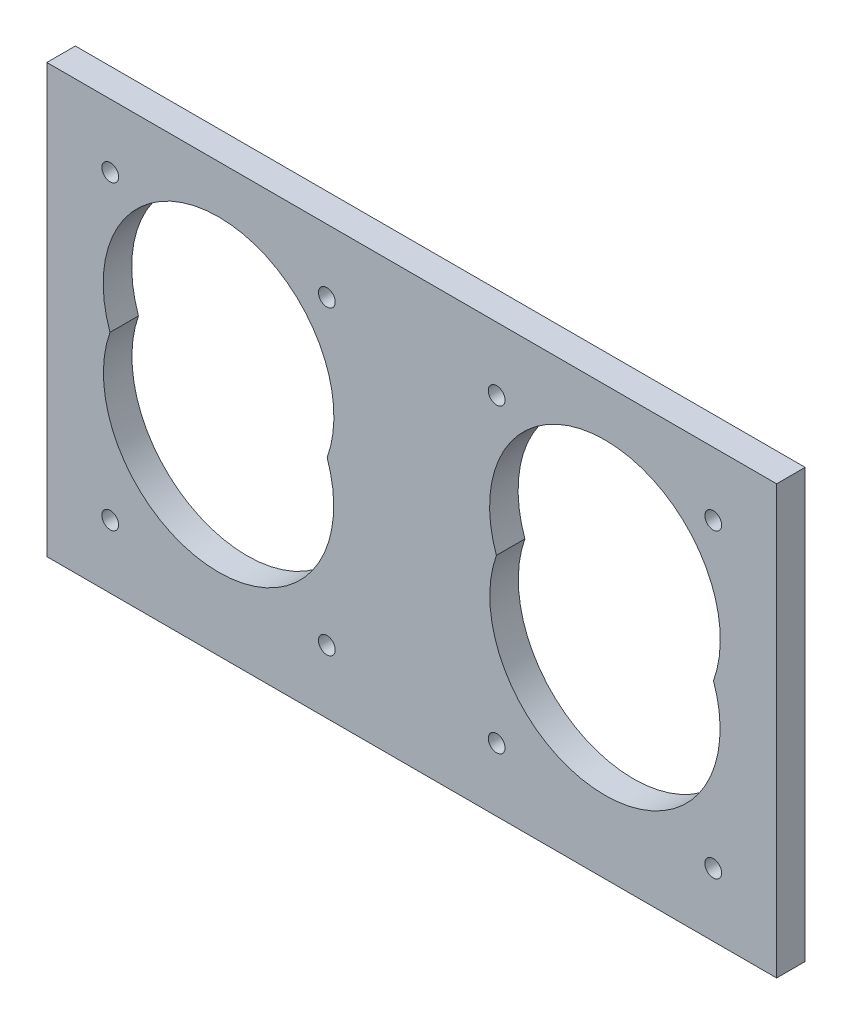
from build123d import *

# Parameters (mm, degrees)
SKETCH1_W           = 64.012274628
SKETCH1_H           = 75.085000506
BOSS_EXTRUDE1_DEPTH = 5
SKETCH7_R           = 1.4732
CUT_EXTRUDE1_DEPTH  = 10


with BuildPart() as part:
    # Sketch1 → Boss-Extrude1 (new body)
    # profile 1 of 2: a face of its own
    with BuildSketch(Plane.XY):
        with Locations((61.398411242, 7.077500224)):
            Rectangle(SKETCH1_W, SKETCH1_H)
        with BuildLine():
            ThreePointArc((83.484398078, 2.429730903), (59.871437613, -17.479677368), (44.238109553, 9.157805497))
            ThreePointArc((44.238109553, 9.157805497), (59.81501285, 35.930775127), (83.520814038, 15.994205484))
            ThreePointArc((83.520814038, 15.994205484), (83.22114917, 12.52456978), (82.331029644, 9.157693158))
            ThreePointArc((82.331029644, 9.157693158), (83.193968093, 5.842784333), (83.484398078, 2.429730903))
        make_face(mode=Mode.SUBTRACT)
    # profile 2 of 2: a face of its own
    with BuildSketch(Plane.XY):
        with Locations((-2.613863386, 7.077500224)):
            Rectangle(SKETCH1_W, SKETCH1_H)
        with BuildLine():
            ThreePointArc((15.69984642, 2.429730903), (-7.913055331, -17.479687433), (-23.546481788, 9.157693158))
            ThreePointArc((-23.546481788, 9.157693158), (-7.969677608, 35.930764895), (15.736182375, 15.994205484))
            ThreePointArc((15.736182375, 15.994205484), (15.436527739, 12.524628574), (14.546438303, 9.157805497))
            ThreePointArc((14.546438303, 9.157805497), (15.409406369, 5.842843047), (15.69984642, 2.429730903))
        make_face(mode=Mode.SUBTRACT)
    extrude(amount=BOSS_EXTRUDE1_DEPTH)

    # Sketch7 → Cut-Extrude1 (cut)
    with BuildSketch(Plane.XY.offset(5)):
        with Locations((-23.500584488, 33.499560055)):
            Circle(SKETCH7_R)
        with Locations((14.49941543, 33.50027263)):
            Circle(SKETCH7_R)
        with Locations((-23.49959354, -19.345440441)):
            Circle(SKETCH7_R)
        with Locations((14.500406379, -19.344727866)):
            Circle(SKETCH7_R)
        with Locations((44.284829686, -19.345328379)):
            Circle(SKETCH7_R)
        with Locations((44.284150424, 33.499672122)):
            Circle(SKETCH7_R)
        with Locations((82.284150347, 33.500160568)):
            Circle(SKETCH7_R)
        with Locations((82.284829608, -19.344839933)):
            Circle(SKETCH7_R)
    extrude(amount=-CUT_EXTRUDE1_DEPTH, mode=Mode.SUBTRACT)


solid = part.part
